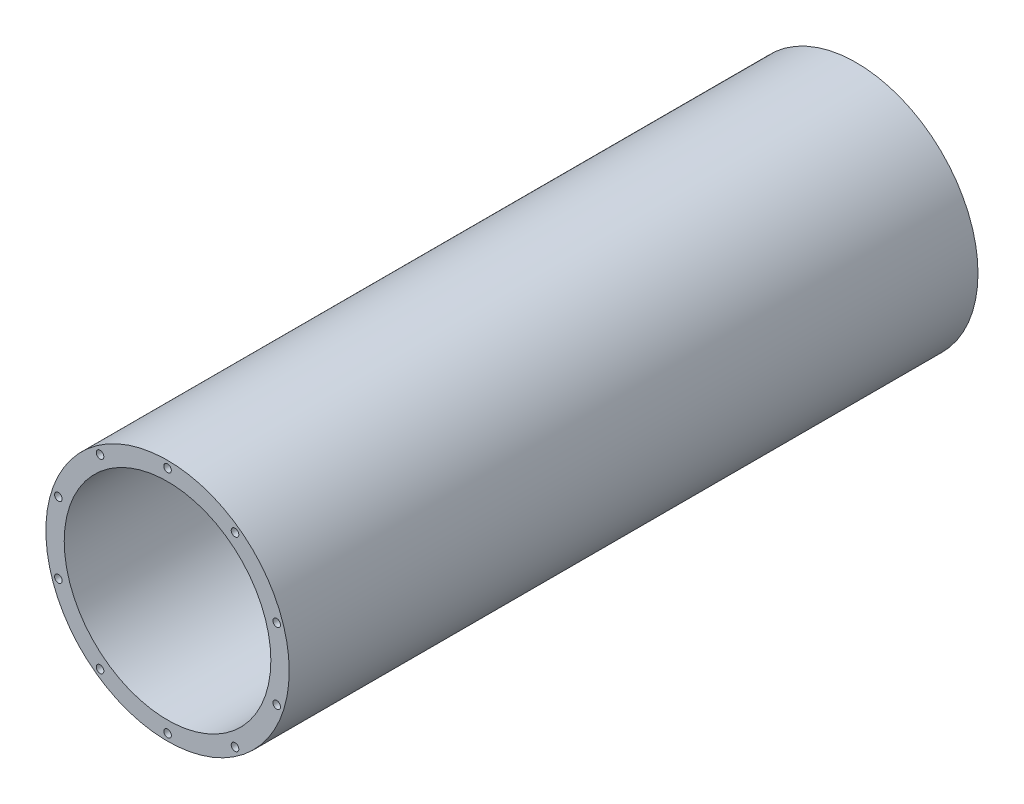
from build123d import *

# Parameters (mm, degrees)
SKETCH_1_R               = 53
EXTRUDE_1_DEPTH          = 300
SKETCH_2_R               = 45
CUT_EXTRUDE_1_DEPTH      = 300
PATTERN_CIRCULAR_1_COUNT = 10
PATTERN_CIRCULAR_2_COUNT = 10


with BuildPart() as part:
    # 草图1 → 凸台-拉伸1 (new body)
    with BuildSketch(Plane.XY):
        Circle(SKETCH_1_R)
    extrude(amount=EXTRUDE_1_DEPTH)

    # 草图2 → 切除-拉伸1 (cut)
    with BuildSketch(Plane(origin=(0, 0, 0), x_dir=(-1, 0, 0), z_dir=(0, 0, -1))):
        Circle(SKETCH_2_R)
    extrude(amount=-CUT_EXTRUDE_1_DEPTH, mode=Mode.SUBTRACT)

    # 草图3 → M4 螺纹孔1 (revolve, cut)
    with BuildSketch(Plane(origin=(0, 50, 0), x_dir=(0, 1, 0), z_dir=(1, 0, 0))):
        Polygon((0, 0), (0, 11.091420021), (1.65, 10.1), (1.65, 0), align=None)
    hole_wizard_m4_1 = revolve(axis=Axis((0, 50, -6.35), (0, 0, 1)), mode=Mode.SUBTRACT)

    # 阵列(圆周)1: M4 螺纹孔1 ×10 about axis
    pattern_circular_1_axis = Axis((0, 0, 300), (0, 0, -1))
    for i in range(1, PATTERN_CIRCULAR_1_COUNT):
        add(hole_wizard_m4_1.rotate(pattern_circular_1_axis, i * 360 / PATTERN_CIRCULAR_1_COUNT), mode=Mode.SUBTRACT)

    # 草图5 → M4 螺纹孔2 (revolve, cut)
    with BuildSketch(Plane(origin=(0, 50, 300), x_dir=(0, -1, 0), z_dir=(1, 0, 0))):
        Polygon((0, 0), (0, 11.091420021), (1.65, 10.1), (1.65, 0), align=None)
    hole_wizard_m4_2 = revolve(axis=Axis((0, 50, 306.35), (0, 0, -1)), mode=Mode.SUBTRACT)

    # 阵列(圆周)2: M4 螺纹孔2 ×10 about axis
    pattern_circular_2_axis = Axis((0, 0, 300), (0, 0, -1))
    for i in range(1, PATTERN_CIRCULAR_2_COUNT):
        add(hole_wizard_m4_2.rotate(pattern_circular_2_axis, i * 360 / PATTERN_CIRCULAR_2_COUNT), mode=Mode.SUBTRACT)


solid = part.part
